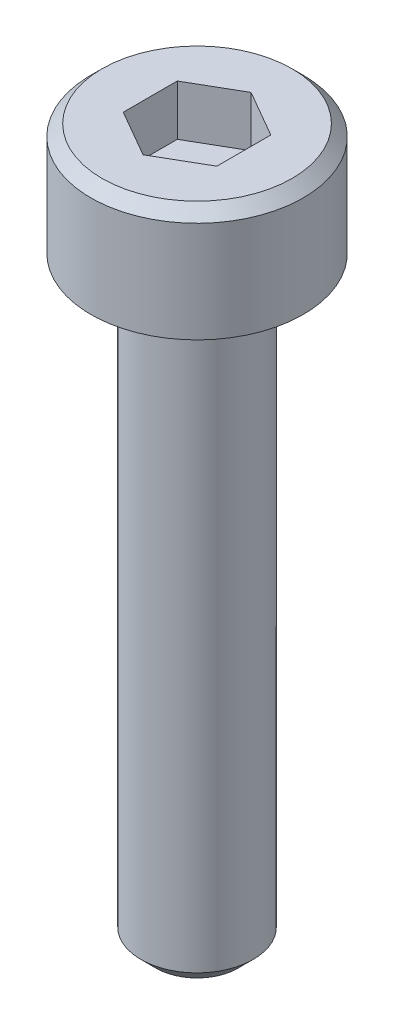
from build123d import *

# Parameters (mm, degrees)
CUT_EXTRUDE1_DEPTH = 1.35


with BuildPart() as part:
    # Sketch1 → Revolve1 (revolve)
    with BuildSketch(Plane.XY, mode=Mode.PRIVATE) as revolve1_sk:
        Polygon((0, -16), (1.1, -16), (1.5, -15.6), (1.5, 0), (2.84, 0), (2.84, 2.7), (2.54, 3), (0, 3), align=None)
    revolve(revolve1_sk.sketch.rotate(Axis((0, -10, 0), (0, 1, 0)), 90), axis=Axis((0, -10, 0), (0, 1, 0)))

    # Sketch2 → Cut-Extrude1 (cut)
    with BuildSketch(Plane(origin=(0, 3, 0), x_dir=(1, 0, 0), z_dir=(0, 1, 0))):
        Polygon((1.25, -0.721687836), (0, -1.443375673), (-1.25, -0.721687836), (-1.25, 0.721687836), (0, 1.443375673), (1.25, 0.721687836), align=None)
    extrude(amount=-CUT_EXTRUDE1_DEPTH, mode=Mode.SUBTRACT)


solid = part.part
